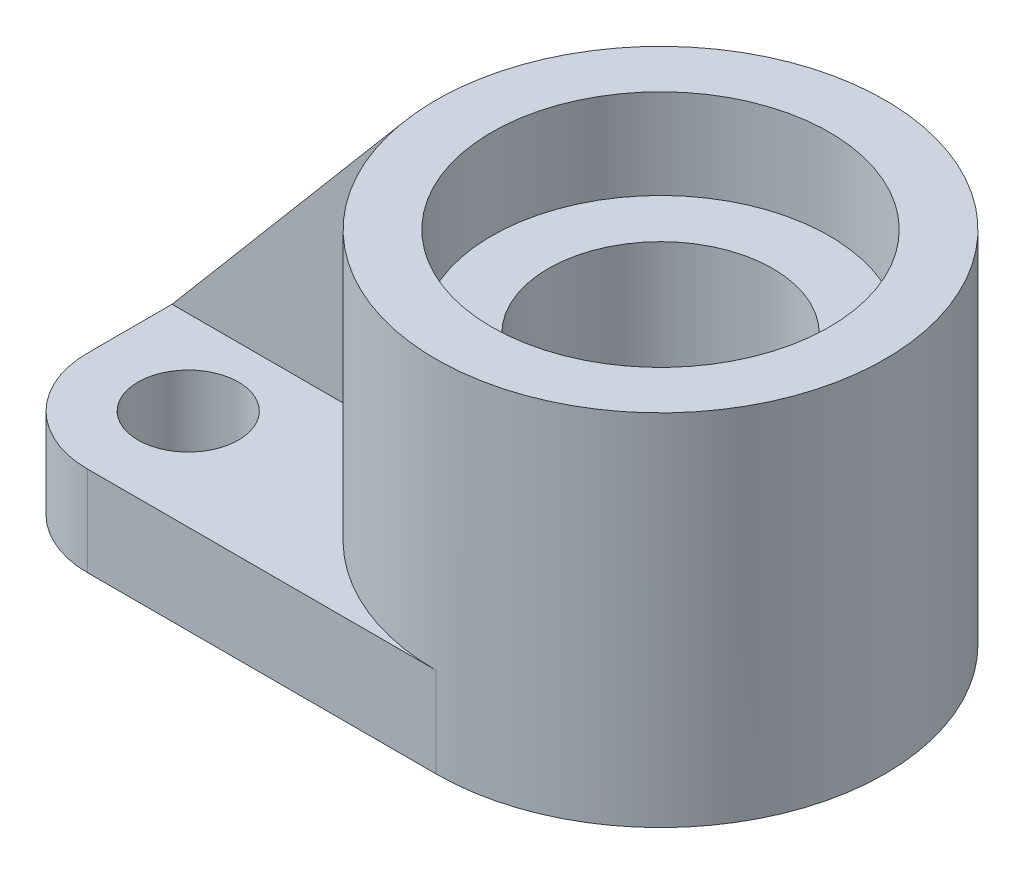
from build123d import *

# Parameters (mm, degrees)
SKETCH1_R                               = 28
BOSS_EXTRUDE1_DEPTH                     = 50
SKETCH1_3_R                             = 125
BOSS_EXTRUDE2_DEPTH                     = 200
CBORE_FOR_M5_HEX_HEAD_BOLT1_D           = 125
CBORE_FOR_M5_HEX_HEAD_BOLT1_DEPTH       = 200
CBORE_FOR_M5_HEX_HEAD_BOLT1_CBORE_D     = 188
CBORE_FOR_M5_HEX_HEAD_BOLT1_CBORE_DEPTH = 50
CBORE_FOR_M5_HEX_HEAD_BOLT1_TIP         = 36.084391824


with BuildPart() as part:
    # Sketch1 → Boss-Extrude1 (new body)
    with BuildSketch(Plane(origin=(0, 0, 0), x_dir=(1, 0, 0), z_dir=(0, 1, 0))):
        with BuildLine():
            ThreePointArc((-125, -69), (-108.597979746, -108.597979746), (-69, -125))
            Line((-69, -125), (125, -125))
            ThreePointArc((125, -125), (0, 0), (125, 125))
            Line((125, 125), (-69, 125))
            ThreePointArc((-69, 125), (-108.597979746, 108.597979746), (-125, 69))
            Line((-125, 69), (-125, -69))
        make_face()
        with Locations((-69, -69)):
            Circle(SKETCH1_R, mode=Mode.SUBTRACT)
        with Locations((-69, 69)):
            Circle(SKETCH1_R, mode=Mode.SUBTRACT)
    extrude(amount=BOSS_EXTRUDE1_DEPTH)

    # Sketch1<3> → Boss-Extrude2 (add)
    with BuildSketch(Plane(origin=(0, 0, 0), x_dir=(1, 0, 0), z_dir=(0, 1, 0))):
        with Locations((125, 0)):
            Circle(SKETCH1_3_R)
    extrude(amount=BOSS_EXTRUDE2_DEPTH)

    # CBORE for M5 Hex Head Bolt1
    with Locations(Plane(origin=(0, 200, 0), x_dir=(1, 0, 0), z_dir=(0, 1, 0))):
        with Locations((125, 0)):
            CounterBoreHole(CBORE_FOR_M5_HEX_HEAD_BOLT1_D / 2, CBORE_FOR_M5_HEX_HEAD_BOLT1_CBORE_D / 2, CBORE_FOR_M5_HEX_HEAD_BOLT1_CBORE_DEPTH, depth=CBORE_FOR_M5_HEX_HEAD_BOLT1_DEPTH)
            with Locations((0, 0, -(CBORE_FOR_M5_HEX_HEAD_BOLT1_DEPTH + CBORE_FOR_M5_HEX_HEAD_BOLT1_TIP / 2))):  # 120° drill point
                Cone(0, CBORE_FOR_M5_HEX_HEAD_BOLT1_D / 2, CBORE_FOR_M5_HEX_HEAD_BOLT1_TIP, mode=Mode.SUBTRACT)

    # Sketch7 → Loft1 section 0
    with BuildSketch(Plane(origin=(0, 50, 0), x_dir=(1, 0, 0), z_dir=(0, 1, 0))):
        with BuildLine():
            Line((-125, 22), (19.117040025, 22))
            Line((19.117040025, 22), (19.117040025, -22))
            Line((19.117040025, -22), (-125, -22))
            Line((-125, -22), (-125, 22))
        make_face()
    # Sketch6 for Loft1 → Loft1 section 1
    with BuildSketch(Plane(origin=(0, 200, 0), x_dir=(1, 0, 0), z_dir=(0, 1, 0))):
        with BuildLine():
            Line((1.951229181, -22), (26.938517531, -22))
            Line((26.938517531, -22), (26.938517531, 22))
            Line((26.938517531, 22), (1.951229181, 22))
            # circular arc as an exact rational Bezier (weights 1, cos(half-angle), 1)
            Bezier((1.951229181, 22), (-1.982170533, 0), (1.951229181, -22), weights=[1, 0.984390167, 1])
        make_face()
    loft()


solid = part.part
